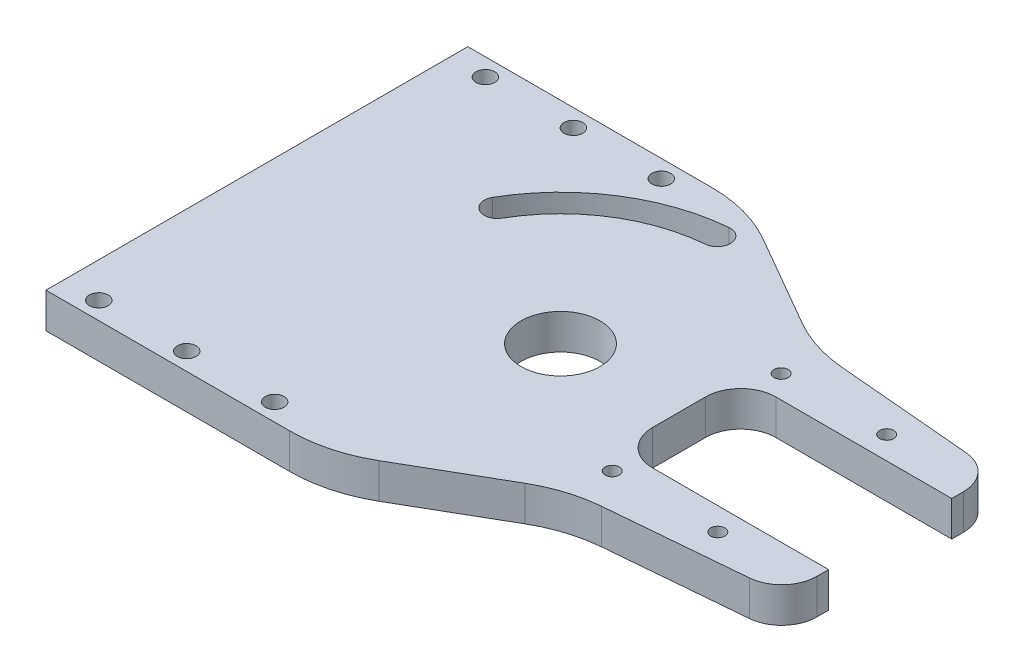
from build123d import *

# Parameters (mm, degrees)
SKETCH2_W                       = 228.6
SKETCH2_H                       = 152.4
BOSS_EXTRUDE1_DEPTH             = 12.7
SKETCH4_W                       = 76.2
SKETCH4_H                       = 44.45
CUT_EXTRUDE1_DEPTH              = 138.957312238
SKETCH5_R                       = 14.2875
CUT_EXTRUDE2_DEPTH              = 138.957312238
CUT_EXTRUDE4_DEPTH              = 138.957312238
TAP_DRILL_FOR_1_4_20_TAP2_D     = 5.1054
FILLET1_R                       = 12.7
TAP_DRILL_FOR_1_4_20_TAP1_D     = 5.1054
TAP_DRILL_FOR_1_4_20_TAP1_DEPTH = 12.7
TAP_DRILL_FOR_1_4_20_TAP1_TIP   = 1.533816902
SKETCH16_W                      = 101.6
SKETCH16_H                      = 12.7
BOSS_EXTRUDE2_DEPTH             = 26.924
BOSS_EXTRUDE3_DEPTH             = 12.7
F_1_4_CLEARANCE_HOLE2_D         = 6.7564
FILLET3_R                       = 50.8
CUT_EXTRUDE5_DEPTH              = 12.7


with BuildPart() as part:
    # Sketch2 → Boss-Extrude1 (new body)
    with BuildSketch(Plane(origin=(0, 0, 0), x_dir=(1, 0, 0), z_dir=(0, 1, 0))):
        Rectangle(SKETCH2_W, SKETCH2_H)
    extrude(amount=-BOSS_EXTRUDE1_DEPTH)

    # Sketch4 → Cut-Extrude1 (cut, through all)
    with BuildSketch(Plane(origin=(0, 0, 0), x_dir=(1, 0, 0), z_dir=(0, 1, 0))):
        with Locations((76.2, 0)):
            Rectangle(SKETCH4_W, SKETCH4_H)
    extrude(amount=-CUT_EXTRUDE1_DEPTH, mode=Mode.SUBTRACT)

    # Sketch5 → Cut-Extrude2 (cut, through all)
    with BuildSketch(Plane(origin=(0, 0, 0), x_dir=(1, 0, 0), z_dir=(0, 1, 0))):
        with Locations(Location((-4.700997292, 0, 0), (0, 0, 270))):
            Circle(SKETCH5_R)
    extrude(amount=-CUT_EXTRUDE2_DEPTH, mode=Mode.SUBTRACT)

    # Sketch8 → Cut-Extrude4 (cut, through all)
    with BuildSketch(Plane(origin=(0, 0, 0), x_dir=(1, 0, 0), z_dir=(0, 1, 0))):
        Polygon((114.3, -38.1), (-12.7, -49.211060268), (-114.3, -49.211060268), (-114.3, -76.2), (114.3, -76.2), align=None)
    cut_extrude4 = extrude(amount=-CUT_EXTRUDE4_DEPTH, mode=Mode.SUBTRACT)

    # Tap Drill for 1/4-20 Tap2 (through all)
    with Locations(Plane(origin=(0, 0, 0), x_dir=(1, 0, 0), z_dir=(0, 1, 0))):
        with Locations((82.55, -30.48), (44.45, -30.48)):
            tap_drill_for_1_4_20_tap2 = Hole(TAP_DRILL_FOR_1_4_20_TAP2_D / 2)

    # Mirror1: Cut-Extrude4, Tap Drill for 1/4-20 Tap2 across plane
    add(cut_extrude4.mirror(Plane.XY), mode=Mode.SUBTRACT)
    add(tap_drill_for_1_4_20_tap2.mirror(Plane.XY), mode=Mode.SUBTRACT)

    # Fillet1
    fillet1_edges = [part.edges().sort_by_distance(p)[0] for p in [
        (38.1, -6.35, 22.225),
        (38.1, -6.35, -22.225),
        (114.3, -6.35, 38.1),
        (114.3, -6.35, -38.1),
    ]]
    fillet(fillet1_edges, radius=FILLET1_R)

    # Tap Drill for 1/4-20 Tap1
    with Locations(Plane.ZY.offset(114.3)):
        with Locations((-44.45, -6.35), (44.45, -6.35)):
            Hole(TAP_DRILL_FOR_1_4_20_TAP1_D / 2, depth=TAP_DRILL_FOR_1_4_20_TAP1_DEPTH)
            with Locations((0, 0, -(TAP_DRILL_FOR_1_4_20_TAP1_DEPTH + TAP_DRILL_FOR_1_4_20_TAP1_TIP / 2))):  # 118° drill point
                Cone(0, TAP_DRILL_FOR_1_4_20_TAP1_D / 2, TAP_DRILL_FOR_1_4_20_TAP1_TIP, mode=Mode.SUBTRACT)

    # Sketch16 → Boss-Extrude2 (add)
    with BuildSketch(Plane.XY.offset(49.211060268)):
        with Locations((-63.5, -6.35)):
            Rectangle(SKETCH16_W, SKETCH16_H)
    boss_extrude2 = extrude(amount=BOSS_EXTRUDE2_DEPTH)

    # Sketch17 → Boss-Extrude3 (add)
    with BuildSketch(Plane.XZ.offset(12.7)):
        Polygon((-12.7, 76.135060268), (42.262462232, 44.402467903), (-12.7, 49.211060268), align=None)
    boss_extrude3 = extrude(amount=-BOSS_EXTRUDE3_DEPTH)

    # 1/4 Clearance Hole2 (through all)
    with Locations(Plane(origin=(0, 0, 0), x_dir=(1, 0, 0), z_dir=(0, 1, 0))):
        with Locations((-101.6, -69.785060268), (-69.85, -69.785060268), (-38.1, -69.785060268)):
            f_1_4_clearance_hole2 = Hole(F_1_4_CLEARANCE_HOLE2_D / 2)

    # Mirror2: Boss-Extrude2, Boss-Extrude3, 1/4 Clearance Hole2 across plane
    add(boss_extrude2.mirror(Plane.XY))
    add(boss_extrude3.mirror(Plane.XY))
    add(f_1_4_clearance_hole2.mirror(Plane.XY), mode=Mode.SUBTRACT)

    # Fillet3
    fillet3_edges = [part.edges().sort_by_distance(p)[0] for p in [
        (-12.7, -6.35, 76.135060268),
        (42.262462232, -6.35, 44.402467903),
        (-12.7, -6.35, -76.135060268),
        (42.262462232, -6.35, -44.402467903),
    ]]
    fillet(fillet3_edges, radius=FILLET3_R)

    # Sketch20 → Cut-Extrude5 (cut)
    with BuildSketch(Plane(origin=(0, 0, 0), x_dir=(1, 0, 0), z_dir=(0, 1, 0))):
        with BuildLine():
            ThreePointArc((-10.539781096, 66.737573312), (-40.696044012, 56.500901434), (-62.718206863, 33.49625))
            ThreePointArc((-62.718206863, 33.49625), (-60.975010878, 26.990554014), (-54.469314892, 28.73375))
            ThreePointArc((-54.469314892, 28.73375), (-35.578265243, 48.467597912), (-9.709622646, 57.248818813))
            ThreePointArc((-9.709622646, 57.248818813), (-5.380324622, 62.408275287), (-10.539781096, 66.737573312))
        make_face()
    extrude(amount=-CUT_EXTRUDE5_DEPTH, mode=Mode.SUBTRACT)


solid = part.part
